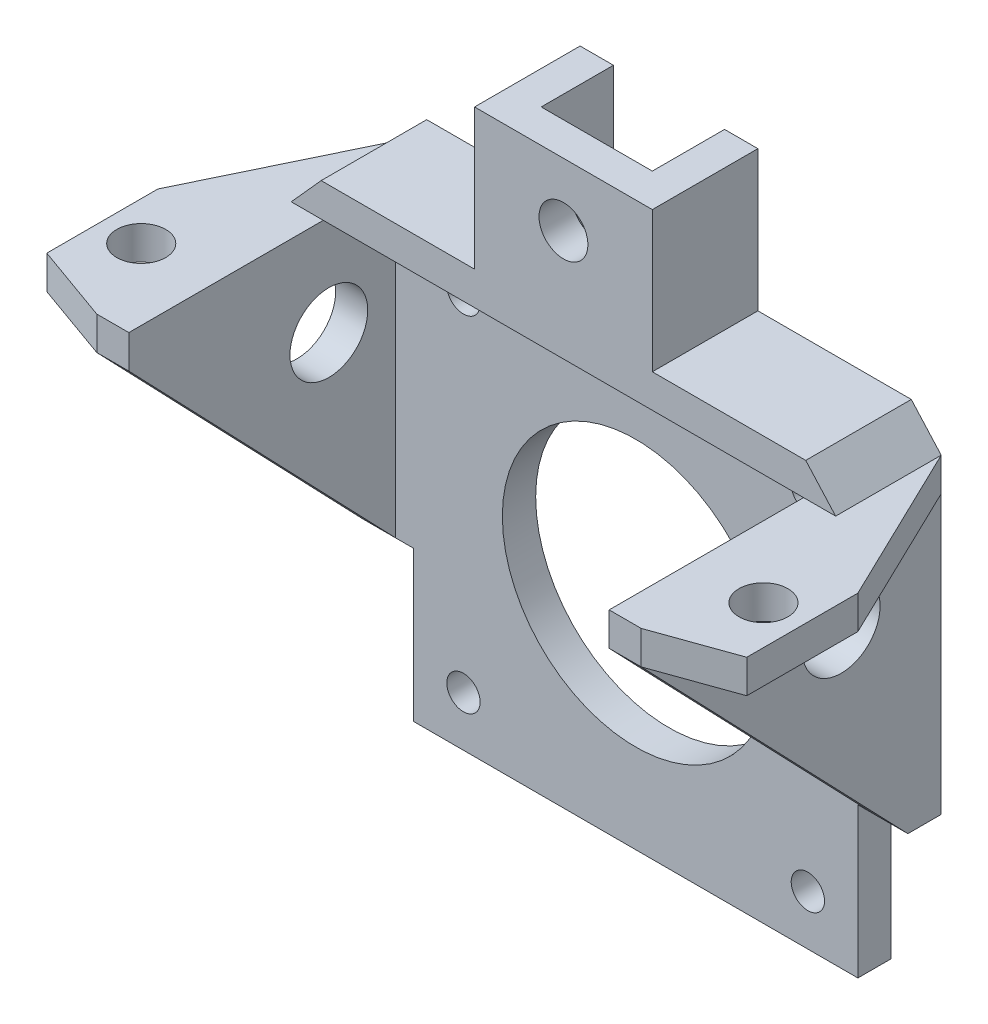
from build123d import *

# Parameters (mm, degrees)
BOSS_EXTRUDE1_DEPTH   = 3
BOSS_EXTRUDE2_DEPTH   = 27
BOSS_EXTRUDE2_2_DEPTH = 27
BOSS_EXTRUDE3_DEPTH   = 3
BOSS_EXTRUDE4_DEPTH   = 6.5
SKETCH5_R             = 3.5
CUT_EXTRUDE1_DEPTH    = 72.292294366
SKETCH6_R             = 2.2
CUT_EXTRUDE2_DEPTH    = 57.599469962
SKETCH7_W             = 10
SKETCH7_H             = 6.5
CUT_EXTRUDE3_DEPTH    = 12.644
SKETCH8_R             = 12
SKETCH8_R_2           = 1.5
CUT_EXTRUDE4_DEPTH    = 53.781068917
SKETCH9_R             = 2.2
CUT_EXTRUDE5_DEPTH    = 51.160654262


with BuildPart() as part:
    # Sketch1 → Boss-Extrude1 (new body)
    with BuildSketch(Plane.XY):
        Polygon((-8, 22.25), (-8, 34.894), (8, 34.894), (8, 22.25), (20, 22.25), (20, -22.25), (-20, -22.25), (-20, 22.25), align=None)
    extrude(amount=BOSS_EXTRUDE1_DEPTH)



with BuildPart() as body_2:
    # Sketch2 → Boss-Extrude2 (new body)
    with BuildSketch(Plane(origin=(0, 0, 0), x_dir=(-1, 0, 0), z_dir=(0, 0, -1))):
        Polygon((31.5, 19.25), (21.614, 19.25), (21.614, -8.75), (24.5, -8.75), (24.5, 16.25), (31.5, 16.25), align=None)
    extrude(amount=-BOSS_EXTRUDE2_DEPTH)


with BuildPart() as body_3:
    # Sketch2 → Boss-Extrude2 2 (new body)
    with BuildSketch(Plane(origin=(0, 0, 0), x_dir=(-1, 0, 0), z_dir=(0, 0, -1))):
        Polygon((-31.5, 16.25), (-31.5, 19.25), (-21.614, 19.25), (-21.614, -8.75), (-24.5, -8.75), (-24.5, 16.25), align=None)
    extrude(amount=-BOSS_EXTRUDE2_2_DEPTH)


with BuildPart() as part_1:
    add(part.part)

    add(body_2.part)  # Boss-Extrude3 merges body 2

    add(body_3.part)  # Boss-Extrude3 merges body 3
    # Sketch3 → Boss-Extrude3 (add)
    with BuildSketch(Plane(origin=(0, 0, 0), x_dir=(-1, 0, 0), z_dir=(0, 0, -1))):
        Polygon((-21.614, -8.75), (21.614, -8.75), (21.614, 19.25), (24.5, 19.25), (21.807, 22.25), (-21.807, 22.25), (-24.5, 19.25), (-21.614, 19.25), align=None)
    extrude(amount=-BOSS_EXTRUDE3_DEPTH)

    # Sketch4 → Boss-Extrude4 (add)
    with BuildSketch(Plane.XY.offset(3)):
        Polygon((-24.5, 19.25), (-21.807, 22.25), (-8, 22.25), (-8, 34.894), (8, 34.894), (8, 22.25), (21.807, 22.25), (24.5, 19.25), align=None)
    extrude(amount=BOSS_EXTRUDE4_DEPTH)

    # Sketch5 → Cut-Extrude1 (cut, through all)
    with BuildSketch(Plane(origin=(24.5, 0, 0), x_dir=(0, 0, -1), z_dir=(1, 0, 0))):
        with Locations(Location((-9, 10.25, 0), (0, 0, 90))):
            Circle(SKETCH5_R)
        Polygon((-27, 16.25), (-3, -8.75), (-27, -8.75), align=None)
    extrude(amount=-CUT_EXTRUDE1_DEPTH, mode=Mode.SUBTRACT)

    # Sketch6 → Cut-Extrude2 (cut, through all)
    with BuildSketch(Plane.XZ.offset(-16.25)):
        with Locations(Location((28, 19.5, 0), (0, 0, 270))):
            Circle(SKETCH6_R)
        with Locations(Location((-28, 19.5, 0), (0, 0, 90))):
            Circle(SKETCH6_R)
        Polygon((24.5, 27), (31.5, 27), (31.5, 24.5), align=None)
        Polygon((24.5, 0), (31.5, 14.5), (31.5, 0), align=None)
        Polygon((-31.5, 0), (-24.5, 0), (-31.5, 14.5), align=None)
        Polygon((-31.5, 24.5), (-24.5, 27), (-31.5, 27), align=None)
    extrude(amount=-CUT_EXTRUDE2_DEPTH, mode=Mode.SUBTRACT)

    # Sketch7 → Cut-Extrude3 (cut)
    with BuildSketch(Plane(origin=(0, 34.894, 0), x_dir=(1, 0, 0), z_dir=(0, 1, 0))):
        with Locations((0, -3.25)):
            Rectangle(SKETCH7_W, SKETCH7_H)
    extrude(amount=-CUT_EXTRUDE3_DEPTH, mode=Mode.SUBTRACT)

    # Sketch8 → Cut-Extrude4 (cut, through all)
    with BuildSketch(Plane.XY.offset(3)):
        with Locations((0, -2.25)):
            Circle(SKETCH8_R)
        with Locations((-15.5, 13.25)):
            Circle(SKETCH8_R_2)
        with Locations((15.5, 13.25)):
            Circle(SKETCH8_R_2)
        with Locations((15.5, -17.75)):
            Circle(SKETCH8_R_2)
        with Locations((-15.5, -17.75)):
            Circle(SKETCH8_R_2)
    extrude(amount=-CUT_EXTRUDE4_DEPTH, mode=Mode.SUBTRACT)

    # Sketch9 → Cut-Extrude5 (cut, through all)
    with BuildSketch(Plane.XY.offset(9.5)):
        with Locations((0, 29.2509)):
            Circle(SKETCH9_R)
    extrude(amount=-CUT_EXTRUDE5_DEPTH, mode=Mode.SUBTRACT)


solid = part_1.part
